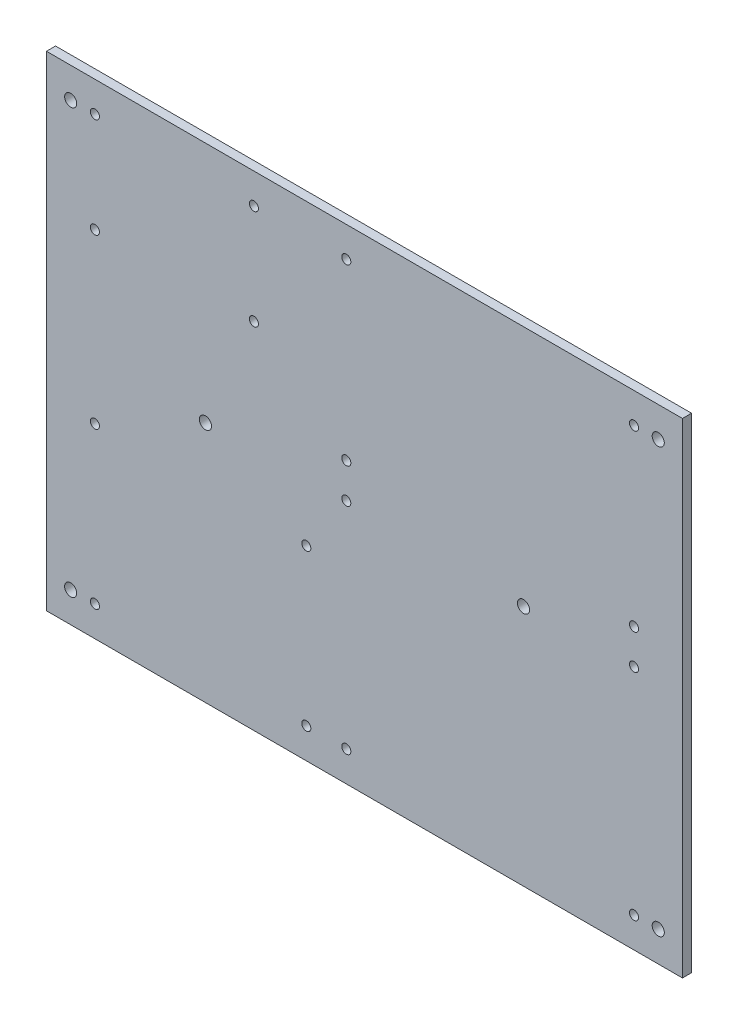
from build123d import *

# Parameters (mm, degrees)
SKETCH1_W           = 210
SKETCH1_H           = 160
SKETCH1_R           = 2
BOSS_EXTRUDE1_DEPTH = 3
SKETCH2_R           = 1.5
LVPCB_HOLE_DEPTH    = 20
SKETCH4_R           = 1.5
SDC_HOLE_DEPTH      = 10
SKETCH3_R           = 1.5
TSAL_LV_HOLE_DEPTH  = 10
SKETCH5_R           = 1.5
BSPD_HOLE_DEPTH     = 10


with BuildPart() as part:
    # Sketch1 → Boss-Extrude1 (new body)
    with BuildSketch(Plane.XY):
        Rectangle(SKETCH1_W, SKETCH1_H)
        with Locations((-97, 70)):
            Circle(SKETCH1_R, mode=Mode.SUBTRACT)
        with Locations((-97, -70)):
            Circle(SKETCH1_R, mode=Mode.SUBTRACT)
        with Locations((97, -70)):
            Circle(SKETCH1_R, mode=Mode.SUBTRACT)
        with Locations((97, 70)):
            Circle(SKETCH1_R, mode=Mode.SUBTRACT)
        with Locations((-52.5, 0)):
            Circle(SKETCH1_R, mode=Mode.SUBTRACT)
        with Locations((52.5, 0)):
            Circle(SKETCH1_R, mode=Mode.SUBTRACT)
    extrude(amount=BOSS_EXTRUDE1_DEPTH)

    # Sketch2 → LVPCB Hole (cut)
    with BuildSketch(Plane.XY.offset(3)):
        with Locations((-6, 70)):
            Circle(SKETCH2_R)
        with Locations((89, 70)):
            Circle(SKETCH2_R)
        with Locations((-6, 12.5)):
            Circle(SKETCH2_R)
        with Locations((89, 12.5)):
            Circle(SKETCH2_R)
    extrude(amount=-LVPCB_HOLE_DEPTH, mode=Mode.SUBTRACT)

    # Sketch4 → SDC Hole (cut)
    with BuildSketch(Plane.XY.offset(3)):
        with Locations((-6, 1)):
            Circle(SKETCH4_R)
        with Locations((89, 1)):
            Circle(SKETCH4_R)
        with Locations((-6, -70)):
            Circle(SKETCH4_R)
        with Locations((89, -70)):
            Circle(SKETCH4_R)
    extrude(amount=-SDC_HOLE_DEPTH, mode=Mode.SUBTRACT)

    # Sketch3 → TSAL LV Hole (cut)
    with BuildSketch(Plane.XY.offset(3)):
        with Locations((-89, -18.5)):
            Circle(SKETCH3_R)
        with Locations((-19.2, -18.5)):
            Circle(SKETCH3_R)
        with Locations((-89, -70)):
            Circle(SKETCH3_R)
        with Locations((-19.2, -70)):
            Circle(SKETCH3_R)
    extrude(amount=-TSAL_LV_HOLE_DEPTH, mode=Mode.SUBTRACT)

    # Sketch5 → BSPD Hole (cut)
    with BuildSketch(Plane.XY.offset(3)):
        with Locations((-89, 70)):
            Circle(SKETCH5_R)
        with Locations((-36.5, 70)):
            Circle(SKETCH5_R)
        with Locations((-89, 37)):
            Circle(SKETCH5_R)
        with Locations((-36.5, 37)):
            Circle(SKETCH5_R)
    extrude(amount=-BSPD_HOLE_DEPTH, mode=Mode.SUBTRACT)


solid = part.part
